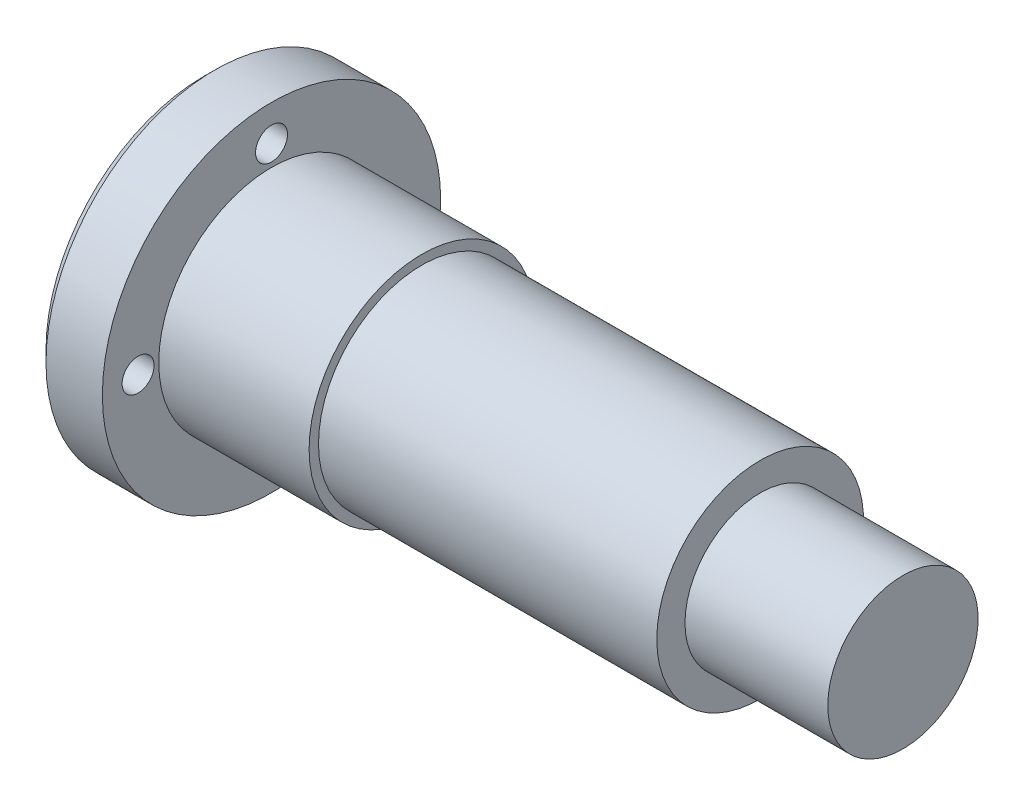
from build123d import *

# Parameters (mm, degrees)
CHAMFER1_SIZE      = 3
CUT_EXTRUDE1_REACH = 198.586
SKETCH2_R          = 4.25


with BuildPart() as part:
    # Sketch1 → Revolve1 (revolve)
    with BuildSketch(Plane.XY, mode=Mode.PRIVATE) as revolve1_sk:
        Polygon((189, 0), (189, 20), (151, 20), (151, 27.5), (61, 27.5), (61, 30), (21, 30), (21, 45), (3, 45), (3, 28), (0, 25), (0, 0), align=None)
    revolve(revolve1_sk.sketch.rotate(Axis((0, 0, 0), (1, 0, 0)), 90), axis=Axis((0, 0, 0), (1, 0, 0)))

    # Chamfer1
    chamfer1_edges = [part.edges().sort_by_distance(p)[0] for p in [
        (3, 0, -45),
    ]]
    chamfer(chamfer1_edges, length=CHAMFER1_SIZE)

    # Sketch2 → Cut-Extrude1 (cut, up to next)
    with BuildSketch(Plane.ZY.offset(-3), mode=Mode.PRIVATE) as cut_extrude1_sk1:
        with Locations((35.5, 0)):
            Circle(SKETCH2_R)
    cut_extrude1_tool1 = extrude(cut_extrude1_sk1.sketch, amount=-CUT_EXTRUDE1_REACH, mode=Mode.PRIVATE) & part.part
    # Sketch2 → Cut-Extrude1 (cut, up to next)
    with BuildSketch(Plane.ZY.offset(-3), mode=Mode.PRIVATE) as cut_extrude1_sk2:
        with Locations((0, -35.5)):
            Circle(SKETCH2_R)
    cut_extrude1_tool2 = extrude(cut_extrude1_sk2.sketch, amount=-CUT_EXTRUDE1_REACH, mode=Mode.PRIVATE) & part.part
    # Sketch2 → Cut-Extrude1 (cut, up to next)
    with BuildSketch(Plane.ZY.offset(-3), mode=Mode.PRIVATE) as cut_extrude1_sk3:
        with Locations((-35.5, 0)):
            Circle(SKETCH2_R)
    cut_extrude1_tool3 = extrude(cut_extrude1_sk3.sketch, amount=-CUT_EXTRUDE1_REACH, mode=Mode.PRIVATE) & part.part
    # Sketch2 → Cut-Extrude1 (cut, up to next)
    with BuildSketch(Plane.ZY.offset(-3), mode=Mode.PRIVATE) as cut_extrude1_sk4:
        with Locations((0, 35.5)):
            Circle(SKETCH2_R)
    cut_extrude1_tool4 = extrude(cut_extrude1_sk4.sketch, amount=-CUT_EXTRUDE1_REACH, mode=Mode.PRIVATE) & part.part
    add(cut_extrude1_tool1.solids().sort_by_distance((3, 0, 35.5))[0], mode=Mode.SUBTRACT)
    add(cut_extrude1_tool2.solids().sort_by_distance((3, -35.5, 0))[0], mode=Mode.SUBTRACT)
    add(cut_extrude1_tool3.solids().sort_by_distance((3, 0, -35.5))[0], mode=Mode.SUBTRACT)
    add(cut_extrude1_tool4.solids().sort_by_distance((3, 35.5, 0))[0], mode=Mode.SUBTRACT)


solid = part.part
